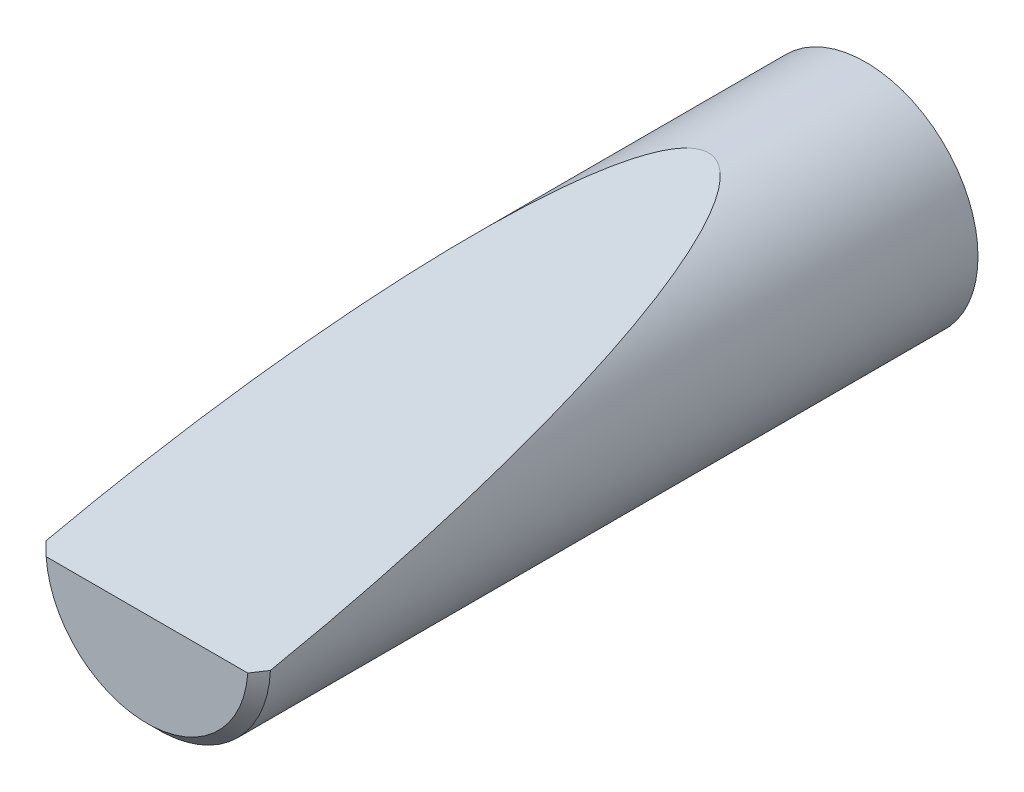
from build123d import *

# Parameters (mm, degrees)
SKETCH_1_R               = 10
EXTRUDE_1_DEPTH          = 64
CHAMFER_1_SIZE           = 1
CUT_EXTRUDE_1_DEPTH      = 66.543878433
CUT_EXTRUDE_1_DEPTH_BACK = 66.543878433
F_8_0MM_1_D              = 8
F_8_0MM_1_DEPTH          = 9.190598923
F_8_0MM_1_CSINK_D        = 12
F_8_0MM_1_CSINK_ANGLE    = 90
F_8_0MM_1_TIP            = 2.309401077


with BuildPart() as part:
    # 草图1 → 凸台-拉伸1 (new body)
    with BuildSketch(Plane.XY):
        Circle(SKETCH_1_R)
    extrude(amount=EXTRUDE_1_DEPTH)

    # 倒角1
    chamfer_1_edges = [part.edges().sort_by_distance(p)[0] for p in [
        (-10, 0, 64),
    ]]
    chamfer(chamfer_1_edges, length=CHAMFER_1_SIZE)

    # 草图2 → 切除-拉伸1 (cut, two sides: drawn at the far end of the back side and taken through both)
    with BuildSketch(Plane(origin=(0, 0, 0), x_dir=(0, 0, -1), z_dir=(1, 0, 0)).offset(-CUT_EXTRUDE_1_DEPTH_BACK)):
        Polygon((-200.698918074, -29.684080093), (-64, -0.627828084), (-14, 10), (122.698918074, 39.05625201), (64.586414054, 312.454088158), (-258.811422094, 243.713756055), align=None)
    extrude(amount=CUT_EXTRUDE_1_DEPTH + CUT_EXTRUDE_1_DEPTH_BACK, mode=Mode.SUBTRACT)

    # Ø8.0mm 暗销孔1
    with Locations(Plane(origin=(0, 0, 0), x_dir=(-1, 0, 0), z_dir=(0, 0, -1))):
        with Locations((0, 0)):
            CounterSinkHole(F_8_0MM_1_D / 2, F_8_0MM_1_CSINK_D / 2, depth=F_8_0MM_1_DEPTH, counter_sink_angle=F_8_0MM_1_CSINK_ANGLE)
            with Locations((0, 0, -(F_8_0MM_1_DEPTH + F_8_0MM_1_TIP / 2))):  # 120° drill point
                Cone(0, F_8_0MM_1_D / 2, F_8_0MM_1_TIP, mode=Mode.SUBTRACT)


solid = part.part
